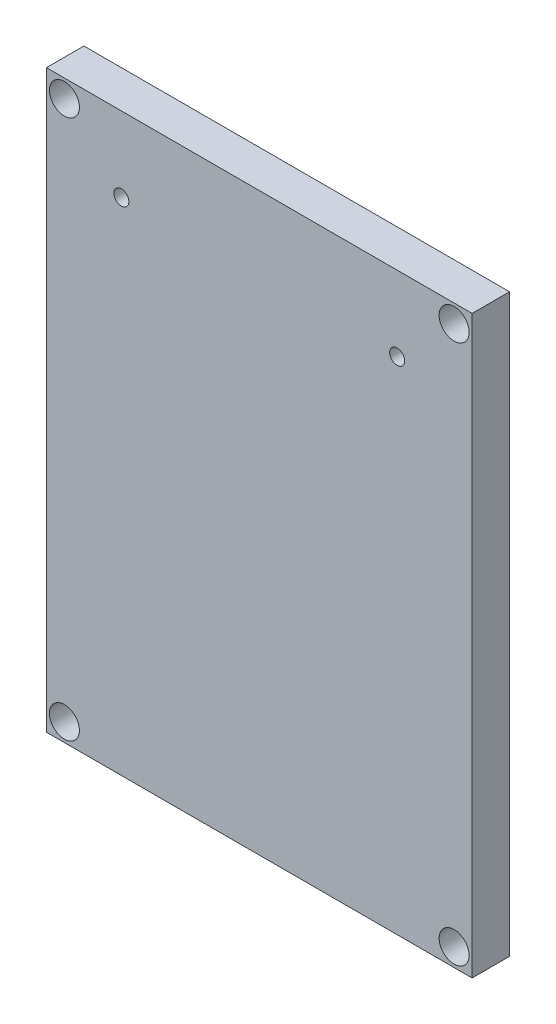
from build123d import *

# Parameters (mm, degrees)
SKETCH1_W           = 72.136
SKETCH1_H           = 97.536
BOSS_EXTRUDE1_DEPTH = 6.35
CUT_EXTRUDE4_REACH  = 123.479
SKETCH12_R          = 2.54
SKETCH13_R          = 1.27
CUT_EXTRUDE5_DEPTH  = 3.81


with BuildPart() as part:
    # Sketch1 → Boss-Extrude1 (new body)
    with BuildSketch(Plane.XY):
        with Locations((36.068, -48.768)):
            Rectangle(SKETCH1_W, SKETCH1_H)
    extrude(amount=BOSS_EXTRUDE1_DEPTH)

    # Sketch12 → Cut-Extrude4 (cut, up to next)
    with BuildSketch(Plane.XY.offset(6.35), mode=Mode.PRIVATE) as cut_extrude4_sk1:
        with Locations((3.048, -3.048)):
            Circle(SKETCH12_R)
    cut_extrude4_tool1 = extrude(cut_extrude4_sk1.sketch, amount=-CUT_EXTRUDE4_REACH, mode=Mode.PRIVATE) & part.part
    # Sketch12 → Cut-Extrude4 (cut, up to next)
    with BuildSketch(Plane.XY.offset(6.35), mode=Mode.PRIVATE) as cut_extrude4_sk2:
        with Locations((69.088, -3.048)):
            Circle(SKETCH12_R)
    cut_extrude4_tool2 = extrude(cut_extrude4_sk2.sketch, amount=-CUT_EXTRUDE4_REACH, mode=Mode.PRIVATE) & part.part
    # Sketch12 → Cut-Extrude4 (cut, up to next)
    with BuildSketch(Plane.XY.offset(6.35), mode=Mode.PRIVATE) as cut_extrude4_sk3:
        with Locations((69.088, -94.488)):
            Circle(SKETCH12_R)
    cut_extrude4_tool3 = extrude(cut_extrude4_sk3.sketch, amount=-CUT_EXTRUDE4_REACH, mode=Mode.PRIVATE) & part.part
    # Sketch12 → Cut-Extrude4 (cut, up to next)
    with BuildSketch(Plane.XY.offset(6.35), mode=Mode.PRIVATE) as cut_extrude4_sk4:
        with Locations((3.048, -94.488)):
            Circle(SKETCH12_R)
    cut_extrude4_tool4 = extrude(cut_extrude4_sk4.sketch, amount=-CUT_EXTRUDE4_REACH, mode=Mode.PRIVATE) & part.part
    add(cut_extrude4_tool1.solids().sort_by_distance((3.048, -3.048, 6.35))[0], mode=Mode.SUBTRACT)
    add(cut_extrude4_tool2.solids().sort_by_distance((69.088, -3.048, 6.35))[0], mode=Mode.SUBTRACT)
    add(cut_extrude4_tool3.solids().sort_by_distance((69.088, -94.488, 6.35))[0], mode=Mode.SUBTRACT)
    add(cut_extrude4_tool4.solids().sort_by_distance((3.048, -94.488, 6.35))[0], mode=Mode.SUBTRACT)

    # Sketch13 → Cut-Extrude5 (cut)
    with BuildSketch(Plane.XY.offset(6.35)):
        with Locations((12.7, -12.7)):
            Circle(SKETCH13_R)
        with Locations((59.436, -12.7)):
            Circle(SKETCH13_R)
    extrude(amount=-CUT_EXTRUDE5_DEPTH, mode=Mode.SUBTRACT)


solid = part.part
